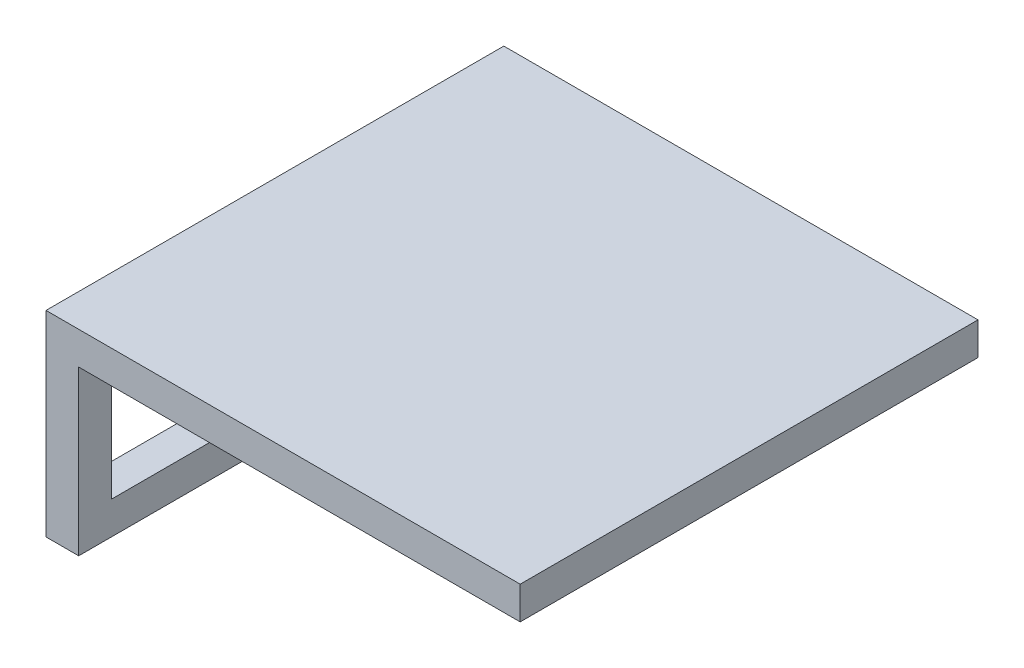
from build123d import *

# Parameters (mm, degrees)
SKETCH1_W           = 5
SKETCH1_H           = 30
SKETCH1_W_2         = 67.5
SKETCH1_H_2         = 5
BOSS_EXTRUDE1_DEPTH = 35
SKETCH2_R           = 1
CUT_EXTRUDE1_DEPTH  = 10
SKETCH3_W           = 60
SKETCH3_H           = 20
CUT_EXTRUDE2_DEPTH  = 10


with BuildPart() as part:
    # Sketch1 → Boss-Extrude1 (new, symmetric)
    with BuildSketch(Plane.XY):
        with Locations((-2.5, 15)):
            Rectangle(SKETCH1_W, SKETCH1_H)
        with Locations((33.75, 27.5)):
            Rectangle(SKETCH1_W_2, SKETCH1_H_2)
    extrude(amount=BOSS_EXTRUDE1_DEPTH, both=True)

    # Sketch2 → Cut-Extrude1 (cut)
    with BuildSketch(Plane.XZ):
        with Locations(Location((-2.5, 10, 0), (0, 0, 270))):
            Circle(SKETCH2_R)
        with Locations(Location((-2.5, -10, 0), (0, 0, 270))):
            Circle(SKETCH2_R)
    extrude(amount=-CUT_EXTRUDE1_DEPTH, mode=Mode.SUBTRACT)

    # Sketch3 → Cut-Extrude2 (cut)
    with BuildSketch(Plane.ZY.offset(5)):
        with Locations((0, 15)):
            Rectangle(SKETCH3_W, SKETCH3_H)
    extrude(amount=-CUT_EXTRUDE2_DEPTH, mode=Mode.SUBTRACT)


solid = part.part
